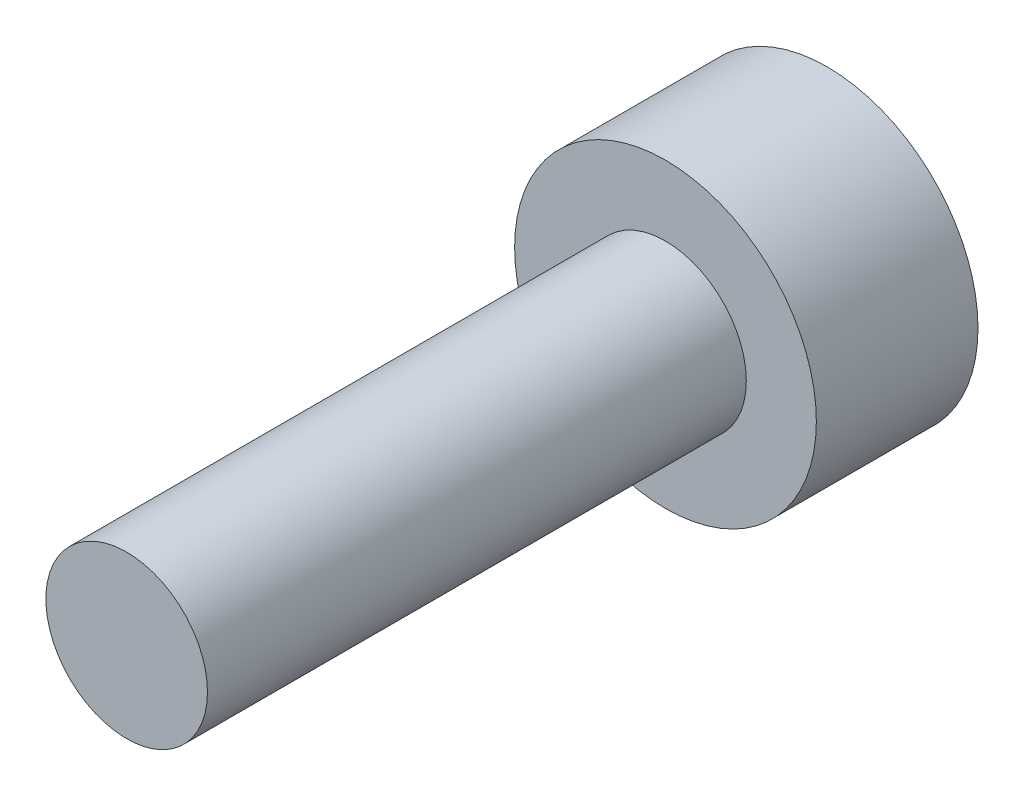
from build123d import *

# Parameters (mm, degrees)
HEAD_START       = -3
SKETCH1_R        = 2.8
HEAD_DEPTH       = 3
SKETCH2_R        = 1.5
SHANK_DEPTH      = 10
HEX_START        = -3.2
HEX_SOCKET_DEPTH = 1.8


with BuildPart() as part:
    # Sketch1 → Head (new body)
    with BuildSketch(Plane.XY.offset(HEAD_START)):
        Circle(SKETCH1_R)
    extrude(amount=HEAD_DEPTH)

    # Sketch2 → Shank (add)
    with BuildSketch(Plane.XY):
        Circle(SKETCH2_R)
    extrude(amount=SHANK_DEPTH)

    # Sketch3 → Hex socket (cut)
    with BuildSketch(Plane.XY.offset(HEX_START)):
        Polygon((1.25, 0.721687836), (0, 1.443375673), (-1.25, 0.721687836), (-1.25, -0.721687836), (0, -1.443375673), (1.25, -0.721687836), align=None)
    extrude(amount=HEX_SOCKET_DEPTH, mode=Mode.SUBTRACT)


solid = part.part
